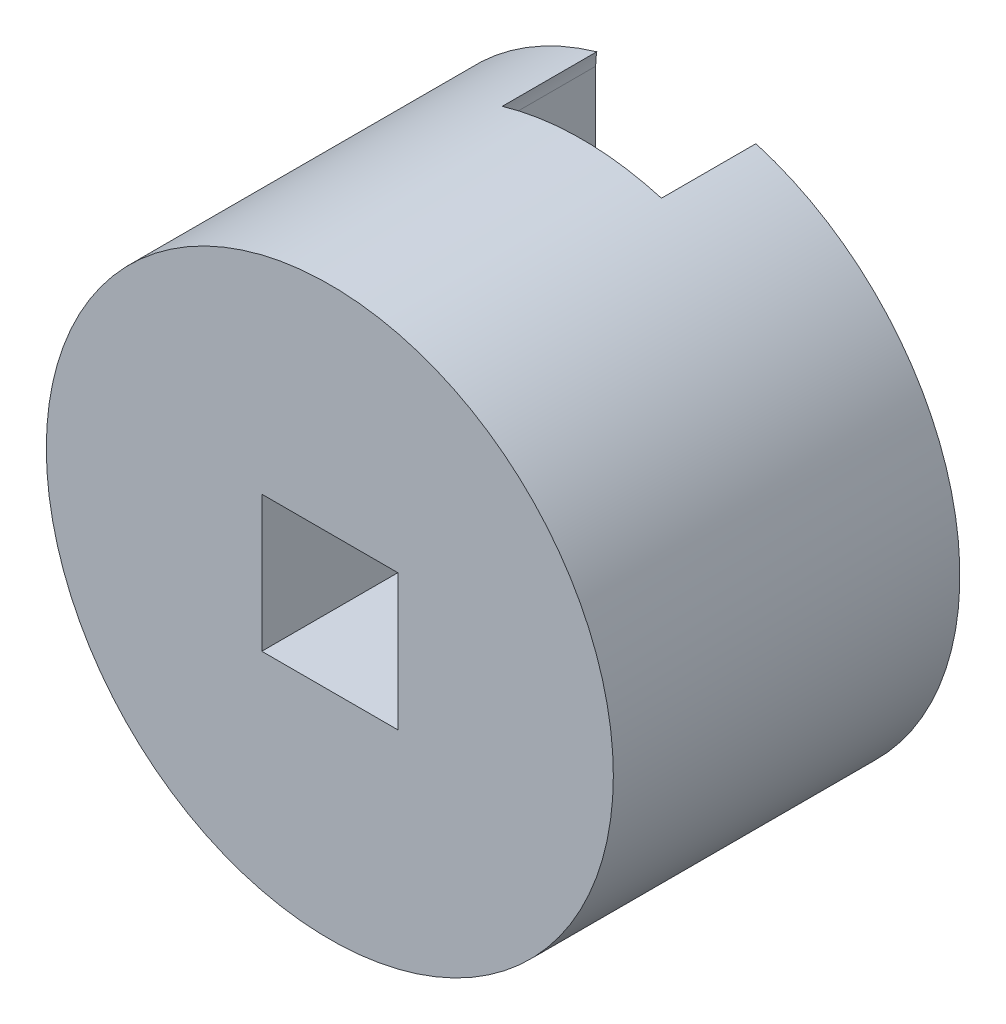
from build123d import *

# Parameters (mm, degrees)
SKETCH1_R               = 9.35355
BOSS_EXTRUDE1_DEPTH     = 2.38125
BOSS_EXTRUDE2_START     = 6.35
SKETCH2_R               = 9.35355
SKETCH2_W               = 3.429
SKETCH2_H               = 3.429
BOSS_EXTRUDE2_DEPTH     = 6.35
SKETCH3_W               = 3.429
SKETCH3_H               = 3.429
SKETCH3_R               = 1.25
BOSS_EXTRUDE3_DEPTH     = 1
CUT_EXTRUDE1_DEPTH      = 20.29812849
CUT_EXTRUDE1_DEPTH_BACK = 20.29812849
SKETCH4_OUTSIDE_W       = 26.28
SKETCH4_OUTSIDE_H       = 26.279
SKETCH4_OUTSIDE_R       = 7.14375


with BuildPart() as part:
    # Sketch1 → Boss-Extrude1 (new body)
    with BuildSketch(Plane.XY.offset(20.11015)):
        with Locations((0, 5.0927)):
            Circle(SKETCH1_R)
        with BuildLine():
            Line((-2.032, 2.088352317), (-2.032, -1.4351))
            ThreePointArc((-2.032, -1.4351), (0, -3.4671), (2.032, -1.4351))
            Line((2.032, -1.4351), (2.032, 2.088352317))
            ThreePointArc((2.032, 2.088352317), (3.627, 5.0927), (2.032, 8.097047683))
            Line((2.032, 8.097047683), (2.032, 11.6205))
            ThreePointArc((2.032, 11.6205), (0, 13.6525), (-2.032, 11.6205))
            Line((-2.032, 11.6205), (-2.032, 8.097047683))
            ThreePointArc((-2.032, 8.097047683), (-3.627, 5.0927), (-2.032, 2.088352317))
        make_face(mode=Mode.SUBTRACT)
    extrude(amount=-BOSS_EXTRUDE1_DEPTH)

    # Sketch2 → Boss-Extrude2 (add)
    with BuildSketch(Plane.XY.offset(20.11015).offset(BOSS_EXTRUDE2_START)):
        with Locations((0, 5.0927)):
            Circle(SKETCH2_R)
        with Locations((0, 5.0927)):
            Rectangle(SKETCH2_W, SKETCH2_H, mode=Mode.SUBTRACT)
    extrude(amount=-BOSS_EXTRUDE2_DEPTH)

    # Sketch3 → Boss-Extrude3 (add)
    with BuildSketch(Plane(origin=(0, 0, 20.11015), x_dir=(-1, 0, 0), z_dir=(0, 0, -1))):
        with Locations((0, 5.0927)):
            Rectangle(SKETCH3_W, SKETCH3_H)
        with Locations((0, 5.0927)):
            Circle(SKETCH3_R, mode=Mode.SUBTRACT)
    extrude(amount=-BOSS_EXTRUDE3_DEPTH)

    # Sketch4 outside → Cut-Extrude1 (cut, two sides: drawn at the far end of the back side and taken through both)
    with BuildSketch(Plane(origin=(0, 0, 17.7289), x_dir=(-1, 0, 0), z_dir=(0, 0, -1)).offset(-CUT_EXTRUDE1_DEPTH_BACK)):
        with Locations((0, 5.0925)):
            Rectangle(SKETCH4_OUTSIDE_W, SKETCH4_OUTSIDE_H)
        with Locations((0, 5.0927)):
            Circle(SKETCH4_OUTSIDE_R, mode=Mode.SUBTRACT)
    extrude(amount=CUT_EXTRUDE1_DEPTH + CUT_EXTRUDE1_DEPTH_BACK, mode=Mode.SUBTRACT)


solid = part.part
